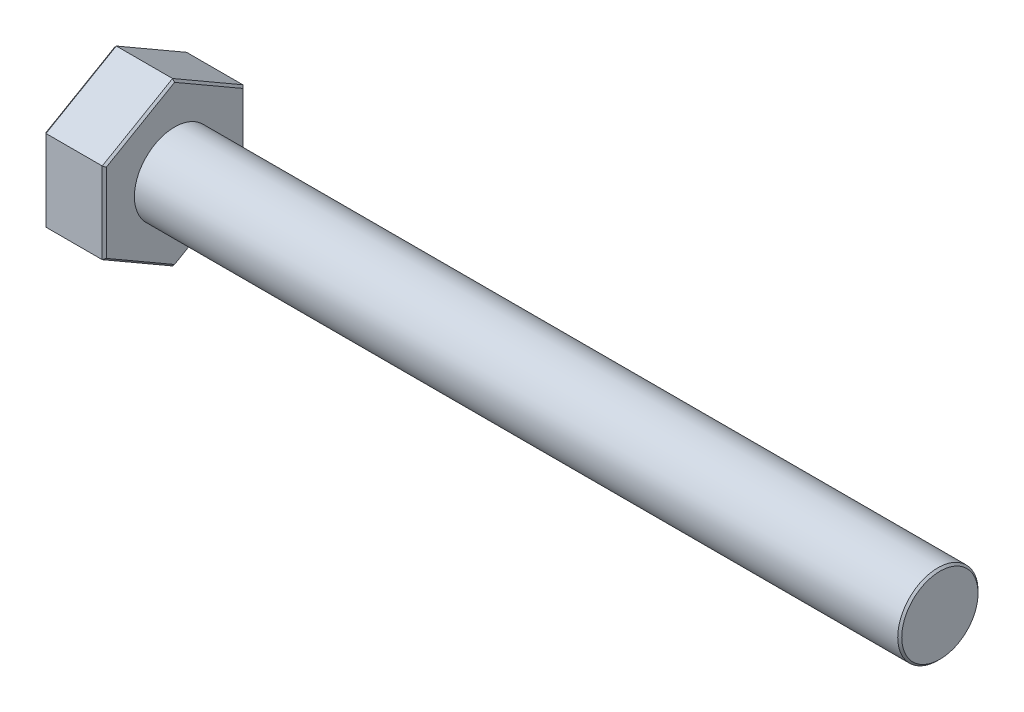
from build123d import *

# Parameters (mm, degrees)
SKETCH1_W           = 38.1
SKETCH1_H           = 2
BOSS_EXTRUDE1_DEPTH = 3
CHAMFER1_SIZE       = 0.1
CHAMFER2_SIZE       = 0.1


with BuildPart() as part:
    # Sketch1 → Revolve1 (revolve)
    with BuildSketch(Plane.XY, mode=Mode.PRIVATE) as revolve1_sk:
        with Locations((19.05, 1)):
            Rectangle(SKETCH1_W, SKETCH1_H)
    revolve(revolve1_sk.sketch.rotate(Axis((-15.554693394, 0, 0), (1, 0, 0)), 90), axis=Axis((-15.554693394, 0, 0), (1, 0, 0)))

    # Sketch2 → Boss-Extrude1 (add)
    with BuildSketch(Plane.ZY):
        Polygon((0, 4.041451884), (-3.5, 2.020725942), (-3.5, -2.020725942), (0, -4.041451884), (3.5, -2.020725942), (3.5, 2.020725942), align=None)
    extrude(amount=BOSS_EXTRUDE1_DEPTH)

    # Chamfer1
    chamfer1_edges = [part.edges().sort_by_distance(p)[0] for p in [
        (0, 3.031088913, -1.75),
        (0, 0, -3.5),
        (0, -3.031088913, -1.75),
        (0, -3.031088913, 1.75),
        (0, 0, 3.5),
        (-3, 3.031088913, 1.75),
        (-3, 3.031088913, -1.75),
        (-3, 0, -3.5),
        (-3, -3.031088913, -1.75),
        (-3, -3.031088913, 1.75),
        (-3, 0, 3.5),
        (0, 3.031088913, 1.75),
    ]]
    chamfer(chamfer1_edges, length=CHAMFER1_SIZE)

    # Chamfer2
    chamfer2_edges = [part.edges().sort_by_distance(p)[0] for p in [
        (38.1, 0, -2),
    ]]
    chamfer(chamfer2_edges, length=CHAMFER2_SIZE)


solid = part.part
